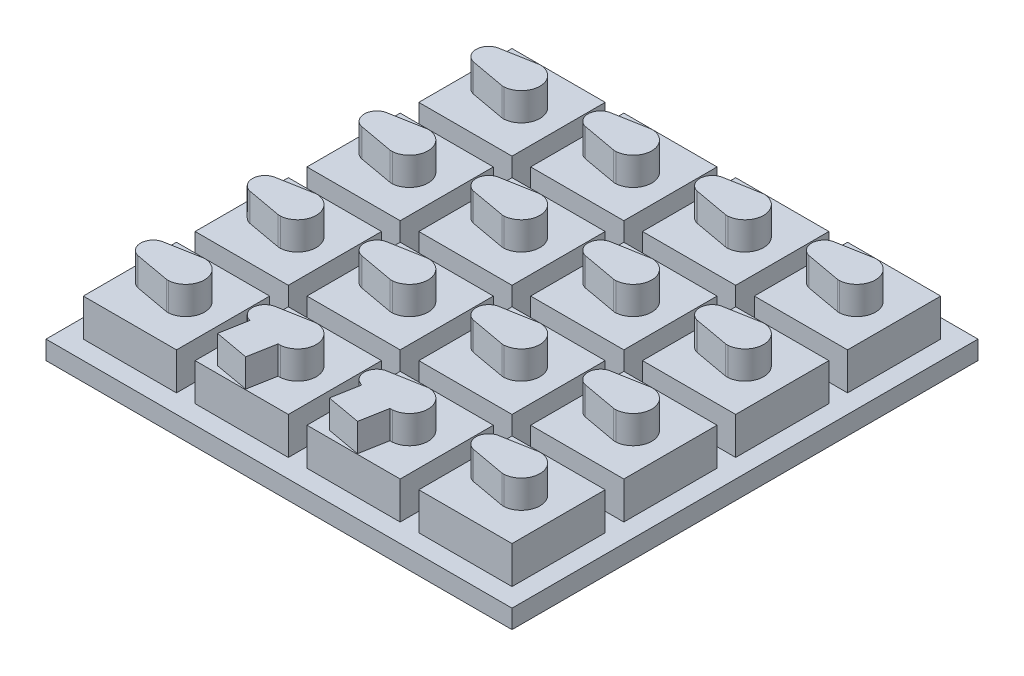
from build123d import *

# Parameters (mm, degrees)
BOSS_EXTRUDE10_DEPTH    = 9
BOSS_EXTRUDE10_2_DEPTH  = 9
BOSS_EXTRUDE10_3_DEPTH  = 9
BOSS_EXTRUDE10_4_DEPTH  = 9
BOSS_EXTRUDE10_5_DEPTH  = 9
BOSS_EXTRUDE10_6_DEPTH  = 9
BOSS_EXTRUDE10_7_DEPTH  = 9
BOSS_EXTRUDE10_8_DEPTH  = 9
BOSS_EXTRUDE10_9_DEPTH  = 9
BOSS_EXTRUDE10_10_DEPTH = 9
BOSS_EXTRUDE10_11_DEPTH = 9
BOSS_EXTRUDE10_12_DEPTH = 9
BOSS_EXTRUDE10_13_DEPTH = 9
BOSS_EXTRUDE10_14_DEPTH = 9
BOSS_EXTRUDE10_15_DEPTH = 9
BOSS_EXTRUDE10_16_DEPTH = 9
SKETCH1_21_W            = 10
SKETCH1_21_H            = 10
BOSS_EXTRUDE11_DEPTH    = 6
SKETCH1_22_W            = 10
SKETCH1_22_H            = 10
BOSS_EXTRUDE12_DEPTH    = 2
SKETCH5_W               = 3.748002025
SKETCH5_H               = 3
BOSS_EXTRUDE13_DEPTH    = 3
SKETCH6_W               = 3.748002025
SKETCH6_H               = 3
BOSS_EXTRUDE14_DEPTH    = 3


with BuildPart() as part:
    # Sketch1 → Boss-Extrude10 (new body)
    with BuildSketch(Plane(origin=(0, 0, 0), x_dir=(1, 0, 0), z_dir=(0, 1, 0))):
        with BuildLine():
            Line((-0.103477426, 1.981305986), (-3.791774707, 1.314985976))
            ThreePointArc((-3.791774707, 1.314985976), (-3.866472803, 1.298518324), (-3.939693652, 1.27638924))
            ThreePointArc((-3.939693652, 1.27638924), (-4.85, 0), (-3.939693652, -1.27638924))
            ThreePointArc((-3.939693652, -1.27638924), (-3.866472803, -1.298518324), (-3.791774707, -1.314985976))
            Line((-3.791774707, -1.314985976), (-0.103477426, -1.981305986))
            ThreePointArc((-0.103477426, -1.981305986), (0.022146835, -1.995874699), (0.14860526, -1.994471478))
            ThreePointArc((0.14860526, -1.994471478), (2, 0), (0.14860526, 1.994471478))
            ThreePointArc((0.14860526, 1.994471478), (0.022146835, 1.995874699), (-0.103477426, 1.981305986))
        make_face()
    extrude(amount=BOSS_EXTRUDE10_DEPTH)



with BuildPart() as body_2:
    # Sketch1 → Boss-Extrude10 2 (new body)
    with BuildSketch(Plane(origin=(0, 0, 0), x_dir=(1, 0, 0), z_dir=(0, 1, 0))):
        with BuildLine():
            Line((-12.103477426, 1.981305986), (-15.791774707, 1.314985976))
            ThreePointArc((-15.791774707, 1.314985976), (-15.866472803, 1.298518324), (-15.939693652, 1.27638924))
            ThreePointArc((-15.939693652, 1.27638924), (-16.85, 0), (-15.939693652, -1.27638924))
            ThreePointArc((-15.939693652, -1.27638924), (-15.866472803, -1.298518324), (-15.791774707, -1.314985976))
            Line((-15.791774707, -1.314985976), (-12.103477426, -1.981305986))
            ThreePointArc((-12.103477426, -1.981305986), (-11.977853165, -1.995874699), (-11.85139474, -1.994471478))
            ThreePointArc((-11.85139474, -1.994471478), (-10, 0), (-11.85139474, 1.994471478))
            ThreePointArc((-11.85139474, 1.994471478), (-11.977853165, 1.995874699), (-12.103477426, 1.981305986))
        make_face()
    extrude(amount=BOSS_EXTRUDE10_2_DEPTH)


with BuildPart() as body_3:
    # Sketch1 → Boss-Extrude10 3 (new body)
    with BuildSketch(Plane(origin=(0, 0, 0), x_dir=(1, 0, 0), z_dir=(0, 1, 0))):
        with BuildLine():
            Line((-24.103477426, 1.981305986), (-27.791774707, 1.314985976))
            ThreePointArc((-27.791774707, 1.314985976), (-27.866472803, 1.298518324), (-27.939693652, 1.27638924))
            ThreePointArc((-27.939693652, 1.27638924), (-28.85, 0), (-27.939693652, -1.27638924))
            ThreePointArc((-27.939693652, -1.27638924), (-27.866472803, -1.298518324), (-27.791774707, -1.314985976))
            Line((-27.791774707, -1.314985976), (-24.103477426, -1.981305986))
            ThreePointArc((-24.103477426, -1.981305986), (-23.977853165, -1.995874699), (-23.85139474, -1.994471478))
            ThreePointArc((-23.85139474, -1.994471478), (-22, 0), (-23.85139474, 1.994471478))
            ThreePointArc((-23.85139474, 1.994471478), (-23.977853165, 1.995874699), (-24.103477426, 1.981305986))
        make_face()
    extrude(amount=BOSS_EXTRUDE10_3_DEPTH)


with BuildPart() as body_4:
    # Sketch1 → Boss-Extrude10 4 (new body)
    with BuildSketch(Plane(origin=(0, 0, 0), x_dir=(1, 0, 0), z_dir=(0, 1, 0))):
        with BuildLine():
            Line((-0.103477426, 13.981305986), (-3.791774707, 13.314985976))
            ThreePointArc((-3.791774707, 13.314985976), (-3.866472803, 13.298518324), (-3.939693652, 13.27638924))
            ThreePointArc((-3.939693652, 13.27638924), (-4.85, 12), (-3.939693652, 10.72361076))
            ThreePointArc((-3.939693652, 10.72361076), (-3.866472803, 10.701481676), (-3.791774707, 10.685014024))
            Line((-3.791774707, 10.685014024), (-0.103477426, 10.018694014))
            ThreePointArc((-0.103477426, 10.018694014), (0.022146835, 10.004125301), (0.14860526, 10.005528522))
            ThreePointArc((0.14860526, 10.005528522), (2, 12), (0.14860526, 13.994471478))
            ThreePointArc((0.14860526, 13.994471478), (0.022146835, 13.995874699), (-0.103477426, 13.981305986))
        make_face()
    extrude(amount=BOSS_EXTRUDE10_4_DEPTH)


with BuildPart() as body_5:
    # Sketch1 → Boss-Extrude10 5 (new body)
    with BuildSketch(Plane(origin=(0, 0, 0), x_dir=(1, 0, 0), z_dir=(0, 1, 0))):
        with BuildLine():
            Line((-12.103477426, 13.981305986), (-15.791774707, 13.314985976))
            ThreePointArc((-15.791774707, 13.314985976), (-15.866472803, 13.298518324), (-15.939693652, 13.27638924))
            ThreePointArc((-15.939693652, 13.27638924), (-16.85, 12), (-15.939693652, 10.72361076))
            ThreePointArc((-15.939693652, 10.72361076), (-15.866472803, 10.701481676), (-15.791774707, 10.685014024))
            Line((-15.791774707, 10.685014024), (-12.103477426, 10.018694014))
            ThreePointArc((-12.103477426, 10.018694014), (-11.977853165, 10.004125301), (-11.85139474, 10.005528522))
            ThreePointArc((-11.85139474, 10.005528522), (-10, 12), (-11.85139474, 13.994471478))
            ThreePointArc((-11.85139474, 13.994471478), (-11.977853165, 13.995874699), (-12.103477426, 13.981305986))
        make_face()
    extrude(amount=BOSS_EXTRUDE10_5_DEPTH)


with BuildPart() as body_6:
    # Sketch1 → Boss-Extrude10 6 (new body)
    with BuildSketch(Plane(origin=(0, 0, 0), x_dir=(1, 0, 0), z_dir=(0, 1, 0))):
        with BuildLine():
            Line((-24.103477426, 13.981305986), (-27.791774707, 13.314985976))
            ThreePointArc((-27.791774707, 13.314985976), (-27.866472803, 13.298518324), (-27.939693652, 13.27638924))
            ThreePointArc((-27.939693652, 13.27638924), (-28.85, 12), (-27.939693652, 10.72361076))
            ThreePointArc((-27.939693652, 10.72361076), (-27.866472803, 10.701481676), (-27.791774707, 10.685014024))
            Line((-27.791774707, 10.685014024), (-24.103477426, 10.018694014))
            ThreePointArc((-24.103477426, 10.018694014), (-23.977853165, 10.004125301), (-23.85139474, 10.005528522))
            ThreePointArc((-23.85139474, 10.005528522), (-22, 12), (-23.85139474, 13.994471478))
            ThreePointArc((-23.85139474, 13.994471478), (-23.977853165, 13.995874699), (-24.103477426, 13.981305986))
        make_face()
    extrude(amount=BOSS_EXTRUDE10_6_DEPTH)


with BuildPart() as body_7:
    # Sketch1 → Boss-Extrude10 7 (new body)
    with BuildSketch(Plane(origin=(0, 0, 0), x_dir=(1, 0, 0), z_dir=(0, 1, 0))):
        with BuildLine():
            Line((-12.103477426, -10.018694014), (-15.791774707, -10.685014024))
            ThreePointArc((-15.791774707, -10.685014024), (-15.866472803, -10.701481676), (-15.939693652, -10.72361076))
            ThreePointArc((-15.939693652, -10.72361076), (-16.85, -12), (-15.939693652, -13.27638924))
            ThreePointArc((-15.939693652, -13.27638924), (-15.866472803, -13.298518324), (-15.791774707, -13.314985976))
            Line((-15.791774707, -13.314985976), (-12.103477426, -13.981305986))
            ThreePointArc((-12.103477426, -13.981305986), (-11.977853165, -13.995874699), (-11.85139474, -13.994471478))
            ThreePointArc((-11.85139474, -13.994471478), (-10, -12), (-11.85139474, -10.005528522))
            ThreePointArc((-11.85139474, -10.005528522), (-11.977853165, -10.004125301), (-12.103477426, -10.018694014))
        make_face()
    extrude(amount=BOSS_EXTRUDE10_7_DEPTH)


with BuildPart() as body_8:
    # Sketch1 → Boss-Extrude10 8 (new body)
    with BuildSketch(Plane(origin=(0, 0, 0), x_dir=(1, 0, 0), z_dir=(0, 1, 0))):
        with BuildLine():
            Line((-0.103477426, -10.018694014), (-3.791774707, -10.685014024))
            ThreePointArc((-3.791774707, -10.685014024), (-3.866472803, -10.701481676), (-3.939693652, -10.72361076))
            ThreePointArc((-3.939693652, -10.72361076), (-4.85, -12), (-3.939693652, -13.27638924))
            ThreePointArc((-3.939693652, -13.27638924), (-3.866472803, -13.298518324), (-3.791774707, -13.314985976))
            Line((-3.791774707, -13.314985976), (-0.103477426, -13.981305986))
            ThreePointArc((-0.103477426, -13.981305986), (0.022146835, -13.995874699), (0.14860526, -13.994471478))
            ThreePointArc((0.14860526, -13.994471478), (2, -12), (0.14860526, -10.005528522))
            ThreePointArc((0.14860526, -10.005528522), (0.022146835, -10.004125301), (-0.103477426, -10.018694014))
        make_face()
    extrude(amount=BOSS_EXTRUDE10_8_DEPTH)


with BuildPart() as body_9:
    # Sketch1 → Boss-Extrude10 9 (new body)
    with BuildSketch(Plane(origin=(0, 0, 0), x_dir=(1, 0, 0), z_dir=(0, 1, 0))):
        with BuildLine():
            Line((-24.103477426, -10.018694014), (-27.791774707, -10.685014024))
            ThreePointArc((-27.791774707, -10.685014024), (-27.866472803, -10.701481676), (-27.939693652, -10.72361076))
            ThreePointArc((-27.939693652, -10.72361076), (-28.85, -12), (-27.939693652, -13.27638924))
            ThreePointArc((-27.939693652, -13.27638924), (-27.866472803, -13.298518324), (-27.791774707, -13.314985976))
            Line((-27.791774707, -13.314985976), (-24.103477426, -13.981305986))
            ThreePointArc((-24.103477426, -13.981305986), (-23.977853165, -13.995874699), (-23.85139474, -13.994471478))
            ThreePointArc((-23.85139474, -13.994471478), (-22, -12), (-23.85139474, -10.005528522))
            ThreePointArc((-23.85139474, -10.005528522), (-23.977853165, -10.004125301), (-24.103477426, -10.018694014))
        make_face()
    extrude(amount=BOSS_EXTRUDE10_9_DEPTH)


with BuildPart() as body_10:
    # Sketch1 → Boss-Extrude10 10 (new body)
    with BuildSketch(Plane(origin=(0, 0, 0), x_dir=(1, 0, 0), z_dir=(0, 1, 0))):
        with BuildLine():
            Line((-0.103477426, 25.981305986), (-3.791774707, 25.314985976))
            ThreePointArc((-3.791774707, 25.314985976), (-3.866472803, 25.298518324), (-3.939693652, 25.27638924))
            ThreePointArc((-3.939693652, 25.27638924), (-4.85, 24), (-3.939693652, 22.72361076))
            ThreePointArc((-3.939693652, 22.72361076), (-3.866472803, 22.701481676), (-3.791774707, 22.685014024))
            Line((-3.791774707, 22.685014024), (-0.103477426, 22.018694014))
            ThreePointArc((-0.103477426, 22.018694014), (0.022146835, 22.004125301), (0.14860526, 22.005528522))
            ThreePointArc((0.14860526, 22.005528522), (2, 24), (0.14860526, 25.994471478))
            ThreePointArc((0.14860526, 25.994471478), (0.022146835, 25.995874699), (-0.103477426, 25.981305986))
        make_face()
    extrude(amount=BOSS_EXTRUDE10_10_DEPTH)


with BuildPart() as body_11:
    # Sketch1 → Boss-Extrude10 11 (new body)
    with BuildSketch(Plane(origin=(0, 0, 0), x_dir=(1, 0, 0), z_dir=(0, 1, 0))):
        with BuildLine():
            Line((-12.103477426, 25.981305986), (-15.791774707, 25.314985976))
            ThreePointArc((-15.791774707, 25.314985976), (-15.866472803, 25.298518324), (-15.939693652, 25.27638924))
            ThreePointArc((-15.939693652, 25.27638924), (-16.85, 24), (-15.939693652, 22.72361076))
            ThreePointArc((-15.939693652, 22.72361076), (-15.866472803, 22.701481676), (-15.791774707, 22.685014024))
            Line((-15.791774707, 22.685014024), (-12.103477426, 22.018694014))
            ThreePointArc((-12.103477426, 22.018694014), (-11.977853165, 22.004125301), (-11.85139474, 22.005528522))
            ThreePointArc((-11.85139474, 22.005528522), (-10, 24), (-11.85139474, 25.994471478))
            ThreePointArc((-11.85139474, 25.994471478), (-11.977853165, 25.995874699), (-12.103477426, 25.981305986))
        make_face()
    extrude(amount=BOSS_EXTRUDE10_11_DEPTH)


with BuildPart() as body_12:
    # Sketch1 → Boss-Extrude10 12 (new body)
    with BuildSketch(Plane(origin=(0, 0, 0), x_dir=(1, 0, 0), z_dir=(0, 1, 0))):
        with BuildLine():
            Line((-24.103477426, 25.981305986), (-27.791774707, 25.314985976))
            ThreePointArc((-27.791774707, 25.314985976), (-27.866472803, 25.298518324), (-27.939693652, 25.27638924))
            ThreePointArc((-27.939693652, 25.27638924), (-28.85, 24), (-27.939693652, 22.72361076))
            ThreePointArc((-27.939693652, 22.72361076), (-27.866472803, 22.701481676), (-27.791774707, 22.685014024))
            Line((-27.791774707, 22.685014024), (-24.103477426, 22.018694014))
            ThreePointArc((-24.103477426, 22.018694014), (-23.977853165, 22.004125301), (-23.85139474, 22.005528522))
            ThreePointArc((-23.85139474, 22.005528522), (-22, 24), (-23.85139474, 25.994471478))
            ThreePointArc((-23.85139474, 25.994471478), (-23.977853165, 25.995874699), (-24.103477426, 25.981305986))
        make_face()
    extrude(amount=BOSS_EXTRUDE10_12_DEPTH)


with BuildPart() as body_13:
    # Sketch1 → Boss-Extrude10 13 (new body)
    with BuildSketch(Plane(origin=(0, 0, 0), x_dir=(1, 0, 0), z_dir=(0, 1, 0))):
        with BuildLine():
            Line((-36.103477426, -10.018694014), (-39.791774707, -10.685014024))
            ThreePointArc((-39.791774707, -10.685014024), (-39.866472803, -10.701481676), (-39.939693652, -10.72361076))
            ThreePointArc((-39.939693652, -10.72361076), (-40.85, -12), (-39.939693652, -13.27638924))
            ThreePointArc((-39.939693652, -13.27638924), (-39.866472803, -13.298518324), (-39.791774707, -13.314985976))
            Line((-39.791774707, -13.314985976), (-36.103477426, -13.981305986))
            ThreePointArc((-36.103477426, -13.981305986), (-35.977853165, -13.995874699), (-35.85139474, -13.994471478))
            ThreePointArc((-35.85139474, -13.994471478), (-34, -12), (-35.85139474, -10.005528522))
            ThreePointArc((-35.85139474, -10.005528522), (-35.977853165, -10.004125301), (-36.103477426, -10.018694014))
        make_face()
    extrude(amount=BOSS_EXTRUDE10_13_DEPTH)


with BuildPart() as body_14:
    # Sketch1 → Boss-Extrude10 14 (new body)
    with BuildSketch(Plane(origin=(0, 0, 0), x_dir=(1, 0, 0), z_dir=(0, 1, 0))):
        with BuildLine():
            Line((-36.103477426, 25.981305986), (-39.791774707, 25.314985976))
            ThreePointArc((-39.791774707, 25.314985976), (-39.866472803, 25.298518324), (-39.939693652, 25.27638924))
            ThreePointArc((-39.939693652, 25.27638924), (-40.85, 24), (-39.939693652, 22.72361076))
            ThreePointArc((-39.939693652, 22.72361076), (-39.866472803, 22.701481676), (-39.791774707, 22.685014024))
            Line((-39.791774707, 22.685014024), (-36.103477426, 22.018694014))
            ThreePointArc((-36.103477426, 22.018694014), (-35.977853165, 22.004125301), (-35.85139474, 22.005528522))
            ThreePointArc((-35.85139474, 22.005528522), (-34, 24), (-35.85139474, 25.994471478))
            ThreePointArc((-35.85139474, 25.994471478), (-35.977853165, 25.995874699), (-36.103477426, 25.981305986))
        make_face()
    extrude(amount=BOSS_EXTRUDE10_14_DEPTH)


with BuildPart() as body_15:
    # Sketch1 → Boss-Extrude10 15 (new body)
    with BuildSketch(Plane(origin=(0, 0, 0), x_dir=(1, 0, 0), z_dir=(0, 1, 0))):
        with BuildLine():
            Line((-36.103477426, 1.981305986), (-39.791774707, 1.314985976))
            ThreePointArc((-39.791774707, 1.314985976), (-39.866472803, 1.298518324), (-39.939693652, 1.27638924))
            ThreePointArc((-39.939693652, 1.27638924), (-40.85, 0), (-39.939693652, -1.27638924))
            ThreePointArc((-39.939693652, -1.27638924), (-39.866472803, -1.298518324), (-39.791774707, -1.314985976))
            Line((-39.791774707, -1.314985976), (-36.103477426, -1.981305986))
            ThreePointArc((-36.103477426, -1.981305986), (-35.977853165, -1.995874699), (-35.85139474, -1.994471478))
            ThreePointArc((-35.85139474, -1.994471478), (-34, 0), (-35.85139474, 1.994471478))
            ThreePointArc((-35.85139474, 1.994471478), (-35.977853165, 1.995874699), (-36.103477426, 1.981305986))
        make_face()
    extrude(amount=BOSS_EXTRUDE10_15_DEPTH)


with BuildPart() as body_16:
    # Sketch1 → Boss-Extrude10 16 (new body)
    with BuildSketch(Plane(origin=(0, 0, 0), x_dir=(1, 0, 0), z_dir=(0, 1, 0))):
        with BuildLine():
            Line((-36.103477426, 13.981305986), (-39.791774707, 13.314985976))
            ThreePointArc((-39.791774707, 13.314985976), (-39.866472803, 13.298518324), (-39.939693652, 13.27638924))
            ThreePointArc((-39.939693652, 13.27638924), (-40.85, 12), (-39.939693652, 10.72361076))
            ThreePointArc((-39.939693652, 10.72361076), (-39.866472803, 10.701481676), (-39.791774707, 10.685014024))
            Line((-39.791774707, 10.685014024), (-36.103477426, 10.018694014))
            ThreePointArc((-36.103477426, 10.018694014), (-35.977853165, 10.004125301), (-35.85139474, 10.005528522))
            ThreePointArc((-35.85139474, 10.005528522), (-34, 12), (-35.85139474, 13.994471478))
            ThreePointArc((-35.85139474, 13.994471478), (-35.977853165, 13.995874699), (-36.103477426, 13.981305986))
        make_face()
    extrude(amount=BOSS_EXTRUDE10_16_DEPTH)


with BuildPart() as part_1:
    add(part.part)

    add(body_2.part)  # Boss-Extrude11 merges body 2

    add(body_3.part)  # Boss-Extrude11 merges body 3

    add(body_4.part)  # Boss-Extrude11 merges body 4

    add(body_5.part)  # Boss-Extrude11 merges body 5

    add(body_6.part)  # Boss-Extrude11 merges body 6

    add(body_7.part)  # Boss-Extrude11 merges body 7

    add(body_8.part)  # Boss-Extrude11 merges body 8

    add(body_9.part)  # Boss-Extrude11 merges body 9

    add(body_10.part)  # Boss-Extrude11 merges body 10

    add(body_11.part)  # Boss-Extrude11 merges body 11

    add(body_12.part)  # Boss-Extrude11 merges body 12

    add(body_13.part)  # Boss-Extrude11 merges body 13

    add(body_14.part)  # Boss-Extrude11 merges body 14

    add(body_15.part)  # Boss-Extrude11 merges body 15

    add(body_16.part)  # Boss-Extrude11 merges body 16
    # Sketch1<21> → Boss-Extrude11 (add)
    # profile 1 of 16: a face of its own
    with BuildSketch(Plane(origin=(0, 0, 0), x_dir=(1, 0, 0), z_dir=(0, 1, 0))):
        with Locations((-37, 24)):
            Rectangle(SKETCH1_21_W, SKETCH1_21_H)
        with BuildLine():
            Line((-39.791774707, 25.314985976), (-36.103477426, 25.981305986))
            ThreePointArc((-36.103477426, 25.981305986), (-35.977853165, 25.995874699), (-35.85139474, 25.994471478))
            ThreePointArc((-35.85139474, 25.994471478), (-34, 24), (-35.85139474, 22.005528522))
            ThreePointArc((-35.85139474, 22.005528522), (-35.977853165, 22.004125301), (-36.103477426, 22.018694014))
            Line((-36.103477426, 22.018694014), (-39.791774707, 22.685014024))
            ThreePointArc((-39.791774707, 22.685014024), (-39.866472803, 22.701481676), (-39.939693652, 22.72361076))
            ThreePointArc((-39.939693652, 22.72361076), (-40.85, 24), (-39.939693652, 25.27638924))
            ThreePointArc((-39.939693652, 25.27638924), (-39.866472803, 25.298518324), (-39.791774707, 25.314985976))
        make_face(mode=Mode.SUBTRACT)
    # profile 2 of 16: a face of its own
    with BuildSketch(Plane(origin=(0, 0, 0), x_dir=(1, 0, 0), z_dir=(0, 1, 0))):
        with Locations((-25, 24)):
            Rectangle(SKETCH1_21_W, SKETCH1_21_H)
        with BuildLine():
            Line((-27.791774707, 25.314985976), (-24.103477426, 25.981305986))
            ThreePointArc((-24.103477426, 25.981305986), (-23.977853165, 25.995874699), (-23.85139474, 25.994471478))
            ThreePointArc((-23.85139474, 25.994471478), (-22, 24), (-23.85139474, 22.005528522))
            ThreePointArc((-23.85139474, 22.005528522), (-23.977853165, 22.004125301), (-24.103477426, 22.018694014))
            Line((-24.103477426, 22.018694014), (-27.791774707, 22.685014024))
            ThreePointArc((-27.791774707, 22.685014024), (-27.866472803, 22.701481676), (-27.939693652, 22.72361076))
            ThreePointArc((-27.939693652, 22.72361076), (-28.85, 24), (-27.939693652, 25.27638924))
            ThreePointArc((-27.939693652, 25.27638924), (-27.866472803, 25.298518324), (-27.791774707, 25.314985976))
        make_face(mode=Mode.SUBTRACT)
    # profile 3 of 16: a face of its own
    with BuildSketch(Plane(origin=(0, 0, 0), x_dir=(1, 0, 0), z_dir=(0, 1, 0))):
        with Locations((-13, 24)):
            Rectangle(SKETCH1_21_W, SKETCH1_21_H)
        with BuildLine():
            Line((-15.791774707, 25.314985976), (-12.103477426, 25.981305986))
            ThreePointArc((-12.103477426, 25.981305986), (-11.977853165, 25.995874699), (-11.85139474, 25.994471478))
            ThreePointArc((-11.85139474, 25.994471478), (-10, 24), (-11.85139474, 22.005528522))
            ThreePointArc((-11.85139474, 22.005528522), (-11.977853165, 22.004125301), (-12.103477426, 22.018694014))
            Line((-12.103477426, 22.018694014), (-15.791774707, 22.685014024))
            ThreePointArc((-15.791774707, 22.685014024), (-15.866472803, 22.701481676), (-15.939693652, 22.72361076))
            ThreePointArc((-15.939693652, 22.72361076), (-16.85, 24), (-15.939693652, 25.27638924))
            ThreePointArc((-15.939693652, 25.27638924), (-15.866472803, 25.298518324), (-15.791774707, 25.314985976))
        make_face(mode=Mode.SUBTRACT)
    # profile 4 of 16: a face of its own
    with BuildSketch(Plane(origin=(0, 0, 0), x_dir=(1, 0, 0), z_dir=(0, 1, 0))):
        with Locations((-1, 24)):
            Rectangle(SKETCH1_21_W, SKETCH1_21_H)
        with BuildLine():
            Line((-3.791774707, 25.314985976), (-0.103477426, 25.981305986))
            ThreePointArc((-0.103477426, 25.981305986), (0.022146835, 25.995874699), (0.14860526, 25.994471478))
            ThreePointArc((0.14860526, 25.994471478), (2, 24), (0.14860526, 22.005528522))
            ThreePointArc((0.14860526, 22.005528522), (0.022146835, 22.004125301), (-0.103477426, 22.018694014))
            Line((-0.103477426, 22.018694014), (-3.791774707, 22.685014024))
            ThreePointArc((-3.791774707, 22.685014024), (-3.866472803, 22.701481676), (-3.939693652, 22.72361076))
            ThreePointArc((-3.939693652, 22.72361076), (-4.85, 24), (-3.939693652, 25.27638924))
            ThreePointArc((-3.939693652, 25.27638924), (-3.866472803, 25.298518324), (-3.791774707, 25.314985976))
        make_face(mode=Mode.SUBTRACT)
    # profile 5 of 16: a face of its own
    with BuildSketch(Plane(origin=(0, 0, 0), x_dir=(1, 0, 0), z_dir=(0, 1, 0))):
        with Locations((-37, 12)):
            Rectangle(SKETCH1_21_W, SKETCH1_21_H)
        with BuildLine():
            Line((-39.791774707, 13.314985976), (-36.103477426, 13.981305986))
            ThreePointArc((-36.103477426, 13.981305986), (-35.977853165, 13.995874699), (-35.85139474, 13.994471478))
            ThreePointArc((-35.85139474, 13.994471478), (-34, 12), (-35.85139474, 10.005528522))
            ThreePointArc((-35.85139474, 10.005528522), (-35.977853165, 10.004125301), (-36.103477426, 10.018694014))
            Line((-36.103477426, 10.018694014), (-39.791774707, 10.685014024))
            ThreePointArc((-39.791774707, 10.685014024), (-39.866472803, 10.701481676), (-39.939693652, 10.72361076))
            ThreePointArc((-39.939693652, 10.72361076), (-40.85, 12), (-39.939693652, 13.27638924))
            ThreePointArc((-39.939693652, 13.27638924), (-39.866472803, 13.298518324), (-39.791774707, 13.314985976))
        make_face(mode=Mode.SUBTRACT)
    # profile 6 of 16: a face of its own
    with BuildSketch(Plane(origin=(0, 0, 0), x_dir=(1, 0, 0), z_dir=(0, 1, 0))):
        with Locations((-25, 12)):
            Rectangle(SKETCH1_21_W, SKETCH1_21_H)
        with BuildLine():
            Line((-27.791774707, 13.314985976), (-24.103477426, 13.981305986))
            ThreePointArc((-24.103477426, 13.981305986), (-23.977853165, 13.995874699), (-23.85139474, 13.994471478))
            ThreePointArc((-23.85139474, 13.994471478), (-22, 12), (-23.85139474, 10.005528522))
            ThreePointArc((-23.85139474, 10.005528522), (-23.977853165, 10.004125301), (-24.103477426, 10.018694014))
            Line((-24.103477426, 10.018694014), (-27.791774707, 10.685014024))
            ThreePointArc((-27.791774707, 10.685014024), (-27.866472803, 10.701481676), (-27.939693652, 10.72361076))
            ThreePointArc((-27.939693652, 10.72361076), (-28.85, 12), (-27.939693652, 13.27638924))
            ThreePointArc((-27.939693652, 13.27638924), (-27.866472803, 13.298518324), (-27.791774707, 13.314985976))
        make_face(mode=Mode.SUBTRACT)
    # profile 7 of 16: a face of its own
    with BuildSketch(Plane(origin=(0, 0, 0), x_dir=(1, 0, 0), z_dir=(0, 1, 0))):
        with Locations((-13, 12)):
            Rectangle(SKETCH1_21_W, SKETCH1_21_H)
        with BuildLine():
            Line((-15.791774707, 13.314985976), (-12.103477426, 13.981305986))
            ThreePointArc((-12.103477426, 13.981305986), (-11.977853165, 13.995874699), (-11.85139474, 13.994471478))
            ThreePointArc((-11.85139474, 13.994471478), (-10, 12), (-11.85139474, 10.005528522))
            ThreePointArc((-11.85139474, 10.005528522), (-11.977853165, 10.004125301), (-12.103477426, 10.018694014))
            Line((-12.103477426, 10.018694014), (-15.791774707, 10.685014024))
            ThreePointArc((-15.791774707, 10.685014024), (-15.866472803, 10.701481676), (-15.939693652, 10.72361076))
            ThreePointArc((-15.939693652, 10.72361076), (-16.85, 12), (-15.939693652, 13.27638924))
            ThreePointArc((-15.939693652, 13.27638924), (-15.866472803, 13.298518324), (-15.791774707, 13.314985976))
        make_face(mode=Mode.SUBTRACT)
    # profile 8 of 16: a face of its own
    with BuildSketch(Plane(origin=(0, 0, 0), x_dir=(1, 0, 0), z_dir=(0, 1, 0))):
        with Locations((-1, 12)):
            Rectangle(SKETCH1_21_W, SKETCH1_21_H)
        with BuildLine():
            Line((-3.791774707, 13.314985976), (-0.103477426, 13.981305986))
            ThreePointArc((-0.103477426, 13.981305986), (0.022146835, 13.995874699), (0.14860526, 13.994471478))
            ThreePointArc((0.14860526, 13.994471478), (2, 12), (0.14860526, 10.005528522))
            ThreePointArc((0.14860526, 10.005528522), (0.022146835, 10.004125301), (-0.103477426, 10.018694014))
            Line((-0.103477426, 10.018694014), (-3.791774707, 10.685014024))
            ThreePointArc((-3.791774707, 10.685014024), (-3.866472803, 10.701481676), (-3.939693652, 10.72361076))
            ThreePointArc((-3.939693652, 10.72361076), (-4.85, 12), (-3.939693652, 13.27638924))
            ThreePointArc((-3.939693652, 13.27638924), (-3.866472803, 13.298518324), (-3.791774707, 13.314985976))
        make_face(mode=Mode.SUBTRACT)
    # profile 9 of 16: a face of its own
    with BuildSketch(Plane(origin=(0, 0, 0), x_dir=(1, 0, 0), z_dir=(0, 1, 0))):
        with Locations((-1, 0)):
            Rectangle(SKETCH1_21_W, SKETCH1_21_H)
        with BuildLine():
            Line((-3.791774707, 1.314985976), (-0.103477426, 1.981305986))
            ThreePointArc((-0.103477426, 1.981305986), (0.022146835, 1.995874699), (0.14860526, 1.994471478))
            ThreePointArc((0.14860526, 1.994471478), (2, 0), (0.14860526, -1.994471478))
            ThreePointArc((0.14860526, -1.994471478), (0.022146835, -1.995874699), (-0.103477426, -1.981305986))
            Line((-0.103477426, -1.981305986), (-3.791774707, -1.314985976))
            ThreePointArc((-3.791774707, -1.314985976), (-3.866472803, -1.298518324), (-3.939693652, -1.27638924))
            ThreePointArc((-3.939693652, -1.27638924), (-4.85, 0), (-3.939693652, 1.27638924))
            ThreePointArc((-3.939693652, 1.27638924), (-3.866472803, 1.298518324), (-3.791774707, 1.314985976))
        make_face(mode=Mode.SUBTRACT)
    # profile 10 of 16: a face of its own
    with BuildSketch(Plane(origin=(0, 0, 0), x_dir=(1, 0, 0), z_dir=(0, 1, 0))):
        with Locations((-13, 0)):
            Rectangle(SKETCH1_21_W, SKETCH1_21_H)
        with BuildLine():
            Line((-15.791774707, 1.314985976), (-12.103477426, 1.981305986))
            ThreePointArc((-12.103477426, 1.981305986), (-11.977853165, 1.995874699), (-11.85139474, 1.994471478))
            ThreePointArc((-11.85139474, 1.994471478), (-10, 0), (-11.85139474, -1.994471478))
            ThreePointArc((-11.85139474, -1.994471478), (-11.977853165, -1.995874699), (-12.103477426, -1.981305986))
            Line((-12.103477426, -1.981305986), (-15.791774707, -1.314985976))
            ThreePointArc((-15.791774707, -1.314985976), (-15.866472803, -1.298518324), (-15.939693652, -1.27638924))
            ThreePointArc((-15.939693652, -1.27638924), (-16.85, 0), (-15.939693652, 1.27638924))
            ThreePointArc((-15.939693652, 1.27638924), (-15.866472803, 1.298518324), (-15.791774707, 1.314985976))
        make_face(mode=Mode.SUBTRACT)
    # profile 11 of 16: a face of its own
    with BuildSketch(Plane(origin=(0, 0, 0), x_dir=(1, 0, 0), z_dir=(0, 1, 0))):
        with Locations((-25, 0)):
            Rectangle(SKETCH1_21_W, SKETCH1_21_H)
        with BuildLine():
            Line((-27.791774707, 1.314985976), (-24.103477426, 1.981305986))
            ThreePointArc((-24.103477426, 1.981305986), (-23.977853165, 1.995874699), (-23.85139474, 1.994471478))
            ThreePointArc((-23.85139474, 1.994471478), (-22, 0), (-23.85139474, -1.994471478))
            ThreePointArc((-23.85139474, -1.994471478), (-23.977853165, -1.995874699), (-24.103477426, -1.981305986))
            Line((-24.103477426, -1.981305986), (-27.791774707, -1.314985976))
            ThreePointArc((-27.791774707, -1.314985976), (-27.866472803, -1.298518324), (-27.939693652, -1.27638924))
            ThreePointArc((-27.939693652, -1.27638924), (-28.85, 0), (-27.939693652, 1.27638924))
            ThreePointArc((-27.939693652, 1.27638924), (-27.866472803, 1.298518324), (-27.791774707, 1.314985976))
        make_face(mode=Mode.SUBTRACT)
    # profile 12 of 16: a face of its own
    with BuildSketch(Plane(origin=(0, 0, 0), x_dir=(1, 0, 0), z_dir=(0, 1, 0))):
        with Locations((-37, 0)):
            Rectangle(SKETCH1_21_W, SKETCH1_21_H)
        with BuildLine():
            Line((-39.791774707, 1.314985976), (-36.103477426, 1.981305986))
            ThreePointArc((-36.103477426, 1.981305986), (-35.977853165, 1.995874699), (-35.85139474, 1.994471478))
            ThreePointArc((-35.85139474, 1.994471478), (-34, 0), (-35.85139474, -1.994471478))
            ThreePointArc((-35.85139474, -1.994471478), (-35.977853165, -1.995874699), (-36.103477426, -1.981305986))
            Line((-36.103477426, -1.981305986), (-39.791774707, -1.314985976))
            ThreePointArc((-39.791774707, -1.314985976), (-39.866472803, -1.298518324), (-39.939693652, -1.27638924))
            ThreePointArc((-39.939693652, -1.27638924), (-40.85, 0), (-39.939693652, 1.27638924))
            ThreePointArc((-39.939693652, 1.27638924), (-39.866472803, 1.298518324), (-39.791774707, 1.314985976))
        make_face(mode=Mode.SUBTRACT)
    # profile 13 of 16: a face of its own
    with BuildSketch(Plane(origin=(0, 0, 0), x_dir=(1, 0, 0), z_dir=(0, 1, 0))):
        with Locations((-37, -12)):
            Rectangle(SKETCH1_21_W, SKETCH1_21_H)
        with BuildLine():
            Line((-39.791774707, -10.685014024), (-36.103477426, -10.018694014))
            ThreePointArc((-36.103477426, -10.018694014), (-35.977853165, -10.004125301), (-35.85139474, -10.005528522))
            ThreePointArc((-35.85139474, -10.005528522), (-34, -12), (-35.85139474, -13.994471478))
            ThreePointArc((-35.85139474, -13.994471478), (-35.977853165, -13.995874699), (-36.103477426, -13.981305986))
            Line((-36.103477426, -13.981305986), (-39.791774707, -13.314985976))
            ThreePointArc((-39.791774707, -13.314985976), (-39.866472803, -13.298518324), (-39.939693652, -13.27638924))
            ThreePointArc((-39.939693652, -13.27638924), (-40.85, -12), (-39.939693652, -10.72361076))
            ThreePointArc((-39.939693652, -10.72361076), (-39.866472803, -10.701481676), (-39.791774707, -10.685014024))
        make_face(mode=Mode.SUBTRACT)
    # profile 14 of 16: a face of its own
    with BuildSketch(Plane(origin=(0, 0, 0), x_dir=(1, 0, 0), z_dir=(0, 1, 0))):
        with Locations((-25, -12)):
            Rectangle(SKETCH1_21_W, SKETCH1_21_H)
        with BuildLine():
            Line((-27.791774707, -10.685014024), (-24.103477426, -10.018694014))
            ThreePointArc((-24.103477426, -10.018694014), (-23.977853165, -10.004125301), (-23.85139474, -10.005528522))
            ThreePointArc((-23.85139474, -10.005528522), (-22, -12), (-23.85139474, -13.994471478))
            ThreePointArc((-23.85139474, -13.994471478), (-23.977853165, -13.995874699), (-24.103477426, -13.981305986))
            Line((-24.103477426, -13.981305986), (-27.791774707, -13.314985976))
            ThreePointArc((-27.791774707, -13.314985976), (-27.866472803, -13.298518324), (-27.939693652, -13.27638924))
            ThreePointArc((-27.939693652, -13.27638924), (-28.85, -12), (-27.939693652, -10.72361076))
            ThreePointArc((-27.939693652, -10.72361076), (-27.866472803, -10.701481676), (-27.791774707, -10.685014024))
        make_face(mode=Mode.SUBTRACT)
    # profile 15 of 16: a face of its own
    with BuildSketch(Plane(origin=(0, 0, 0), x_dir=(1, 0, 0), z_dir=(0, 1, 0))):
        with Locations((-13, -12)):
            Rectangle(SKETCH1_21_W, SKETCH1_21_H)
        with BuildLine():
            Line((-15.791774707, -10.685014024), (-12.103477426, -10.018694014))
            ThreePointArc((-12.103477426, -10.018694014), (-11.977853165, -10.004125301), (-11.85139474, -10.005528522))
            ThreePointArc((-11.85139474, -10.005528522), (-10, -12), (-11.85139474, -13.994471478))
            ThreePointArc((-11.85139474, -13.994471478), (-11.977853165, -13.995874699), (-12.103477426, -13.981305986))
            Line((-12.103477426, -13.981305986), (-15.791774707, -13.314985976))
            ThreePointArc((-15.791774707, -13.314985976), (-15.866472803, -13.298518324), (-15.939693652, -13.27638924))
            ThreePointArc((-15.939693652, -13.27638924), (-16.85, -12), (-15.939693652, -10.72361076))
            ThreePointArc((-15.939693652, -10.72361076), (-15.866472803, -10.701481676), (-15.791774707, -10.685014024))
        make_face(mode=Mode.SUBTRACT)
    # profile 16 of 16: a face of its own
    with BuildSketch(Plane(origin=(0, 0, 0), x_dir=(1, 0, 0), z_dir=(0, 1, 0))):
        with Locations((-1, -12)):
            Rectangle(SKETCH1_21_W, SKETCH1_21_H)
        with BuildLine():
            Line((-3.791774707, -10.685014024), (-0.103477426, -10.018694014))
            ThreePointArc((-0.103477426, -10.018694014), (0.022146835, -10.004125301), (0.14860526, -10.005528522))
            ThreePointArc((0.14860526, -10.005528522), (2, -12), (0.14860526, -13.994471478))
            ThreePointArc((0.14860526, -13.994471478), (0.022146835, -13.995874699), (-0.103477426, -13.981305986))
            Line((-0.103477426, -13.981305986), (-3.791774707, -13.314985976))
            ThreePointArc((-3.791774707, -13.314985976), (-3.866472803, -13.298518324), (-3.939693652, -13.27638924))
            ThreePointArc((-3.939693652, -13.27638924), (-4.85, -12), (-3.939693652, -10.72361076))
            ThreePointArc((-3.939693652, -10.72361076), (-3.866472803, -10.701481676), (-3.791774707, -10.685014024))
        make_face(mode=Mode.SUBTRACT)
    extrude(amount=BOSS_EXTRUDE11_DEPTH)

    # Sketch1<22> → Boss-Extrude12 (add)
    with BuildSketch(Plane(origin=(0, 0, 0), x_dir=(1, 0, 0), z_dir=(0, 1, 0))):
        Polygon((4, 31), (-42, 31), (-44, 31), (-44, 29), (-44, -17), (-44, -19), (-42, -19), (4, -19), (6, -19), (6, -17), (6, 29), (6, 31), align=None)
        with Locations((-37, -12)):
            Rectangle(SKETCH1_22_W, SKETCH1_22_H, mode=Mode.SUBTRACT)
        with Locations((-25, -12)):
            Rectangle(SKETCH1_22_W, SKETCH1_22_H, mode=Mode.SUBTRACT)
        with Locations((-37, 0)):
            Rectangle(SKETCH1_22_W, SKETCH1_22_H, mode=Mode.SUBTRACT)
        with Locations((-25, 0)):
            Rectangle(SKETCH1_22_W, SKETCH1_22_H, mode=Mode.SUBTRACT)
        with Locations((-13, -12)):
            Rectangle(SKETCH1_22_W, SKETCH1_22_H, mode=Mode.SUBTRACT)
        with Locations((-1, -12)):
            Rectangle(SKETCH1_22_W, SKETCH1_22_H, mode=Mode.SUBTRACT)
        with Locations((-13, 0)):
            Rectangle(SKETCH1_22_W, SKETCH1_22_H, mode=Mode.SUBTRACT)
        with Locations((-1, 0)):
            Rectangle(SKETCH1_22_W, SKETCH1_22_H, mode=Mode.SUBTRACT)
        with Locations((-37, 12)):
            Rectangle(SKETCH1_22_W, SKETCH1_22_H, mode=Mode.SUBTRACT)
        with Locations((-25, 12)):
            Rectangle(SKETCH1_22_W, SKETCH1_22_H, mode=Mode.SUBTRACT)
        with Locations((-37, 24)):
            Rectangle(SKETCH1_22_W, SKETCH1_22_H, mode=Mode.SUBTRACT)
        with Locations((-25, 24)):
            Rectangle(SKETCH1_22_W, SKETCH1_22_H, mode=Mode.SUBTRACT)
        with Locations((-13, 12)):
            Rectangle(SKETCH1_22_W, SKETCH1_22_H, mode=Mode.SUBTRACT)
        with Locations((-1, 12)):
            Rectangle(SKETCH1_22_W, SKETCH1_22_H, mode=Mode.SUBTRACT)
        with Locations((-13, 24)):
            Rectangle(SKETCH1_22_W, SKETCH1_22_H, mode=Mode.SUBTRACT)
        with Locations((-1, 24)):
            Rectangle(SKETCH1_22_W, SKETCH1_22_H, mode=Mode.SUBTRACT)
    extrude(amount=BOSS_EXTRUDE12_DEPTH)

    # Sketch5 → Boss-Extrude13 (add)
    with BuildSketch(Plane(origin=(-2.828541872, 0, 15.656896288), x_dir=(0.9840702473294003, 0, 0.1777800560272525), z_dir=(-0.17778005602725253, 0, 0.9840702473294003))):
        with Locations((-11.299075675, 7.5)):
            Rectangle(SKETCH5_W, SKETCH5_H)
    extrude(amount=BOSS_EXTRUDE13_DEPTH)

    # Sketch6 → Boss-Extrude14 (add)
    with BuildSketch(Plane(origin=(-3.207810852, 0, 17.756273052), x_dir=(0.9840702473294001, 0, 0.17778005602725364), z_dir=(-0.17778005602725366, 0, 0.9840702473294001))):
        with Locations((-23.107918643, 7.5)):
            Rectangle(SKETCH6_W, SKETCH6_H)
    extrude(amount=BOSS_EXTRUDE14_DEPTH)


solid = part_1.part
